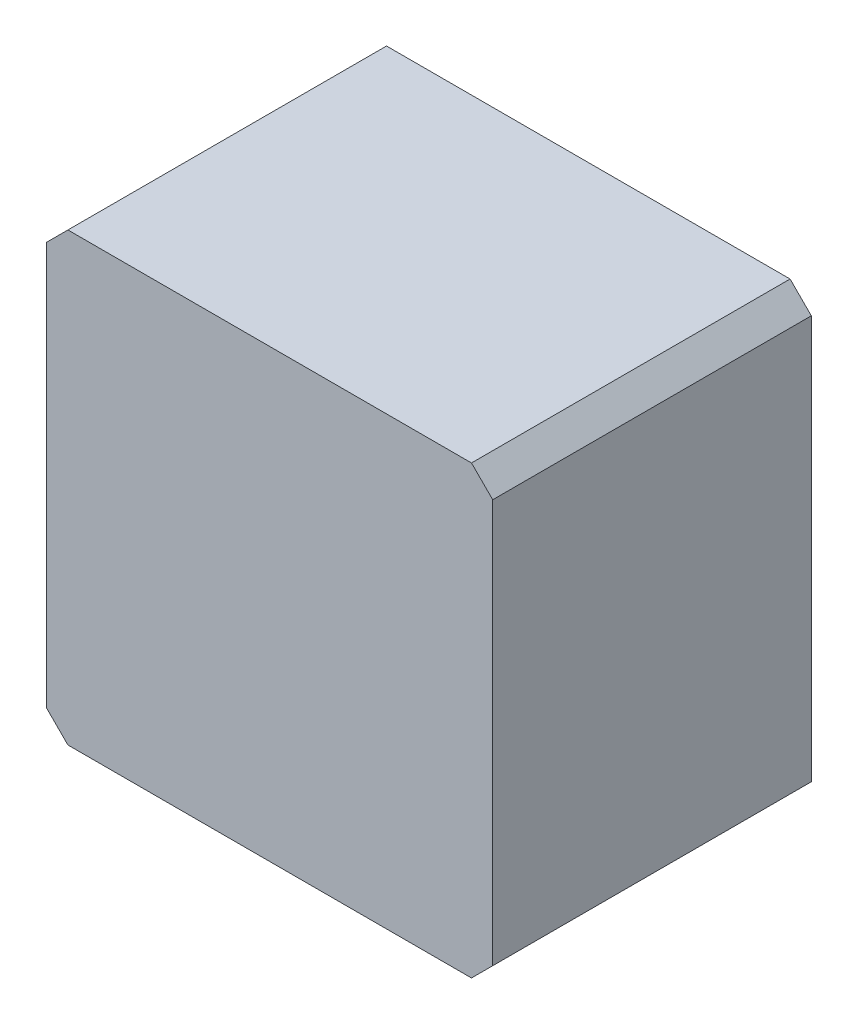
from build123d import *

# Parameters (mm, degrees)
BOSS_EXTRUDE1_DEPTH = 30


with BuildPart() as part:
    # Sketch1 → Boss-Extrude1 (new body)
    with BuildSketch(Plane.XY):
        Polygon((-21, 19), (-19, 21), (19, 21), (21, 19), (21, -19), (19, -21), (-19, -21), (-21, -19), align=None)
    extrude(amount=BOSS_EXTRUDE1_DEPTH)


solid = part.part
